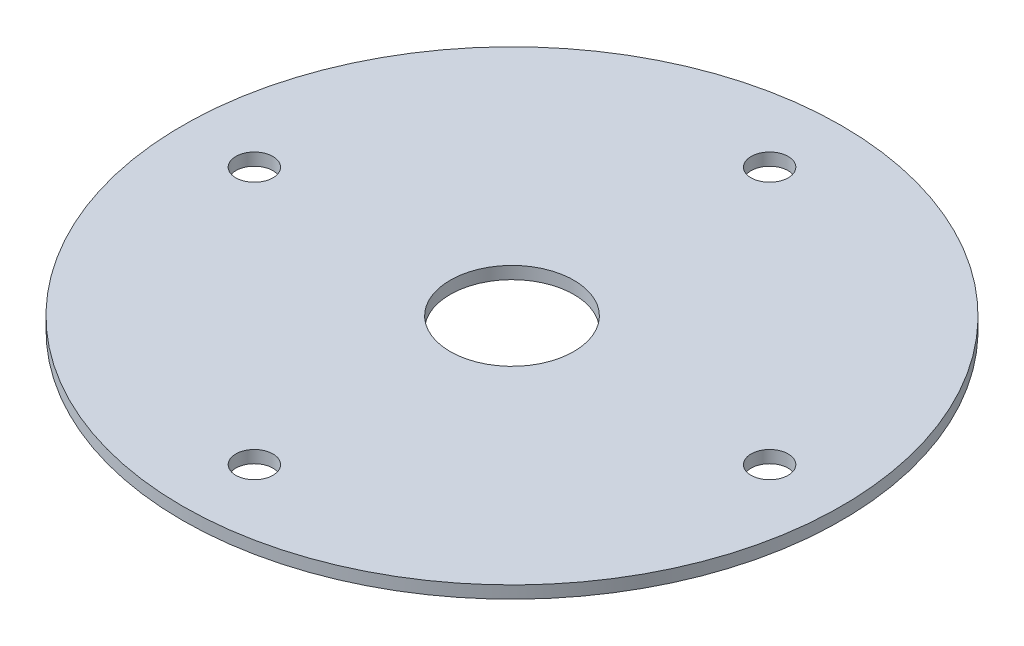
from build123d import *

# Parameters (mm, degrees)
SKETCH1_R           = 79.95
SKETCH1_R_2         = 15
SKETCH1_R_3         = 4.5
BOSS_EXTRUDE1_DEPTH = 3


with BuildPart() as part:
    # Sketch1 → Boss-Extrude1 (new body)
    with BuildSketch(Plane(origin=(0, 0, 0), x_dir=(1, 0, 0), z_dir=(0, 1, 0))):
        with Locations(Location((0, 0, 0), (0, 0, 270))):
            Circle(SKETCH1_R)
        with Locations(Location((0, 0, 0), (0, 0, 270))):
            Circle(SKETCH1_R_2, mode=Mode.SUBTRACT)
        with Locations(Location((0, 62.5, 0), (0, 0, 270))):
            Circle(SKETCH1_R_3, mode=Mode.SUBTRACT)
        with Locations(Location((62.5, 0, 0), (0, 0, 270))):
            Circle(SKETCH1_R_3, mode=Mode.SUBTRACT)
        with Locations(Location((0, -62.5, 0), (0, 0, 270))):
            Circle(SKETCH1_R_3, mode=Mode.SUBTRACT)
        with Locations(Location((-62.5, 0, 0), (0, 0, 270))):
            Circle(SKETCH1_R_3, mode=Mode.SUBTRACT)
    extrude(amount=BOSS_EXTRUDE1_DEPTH)


solid = part.part
